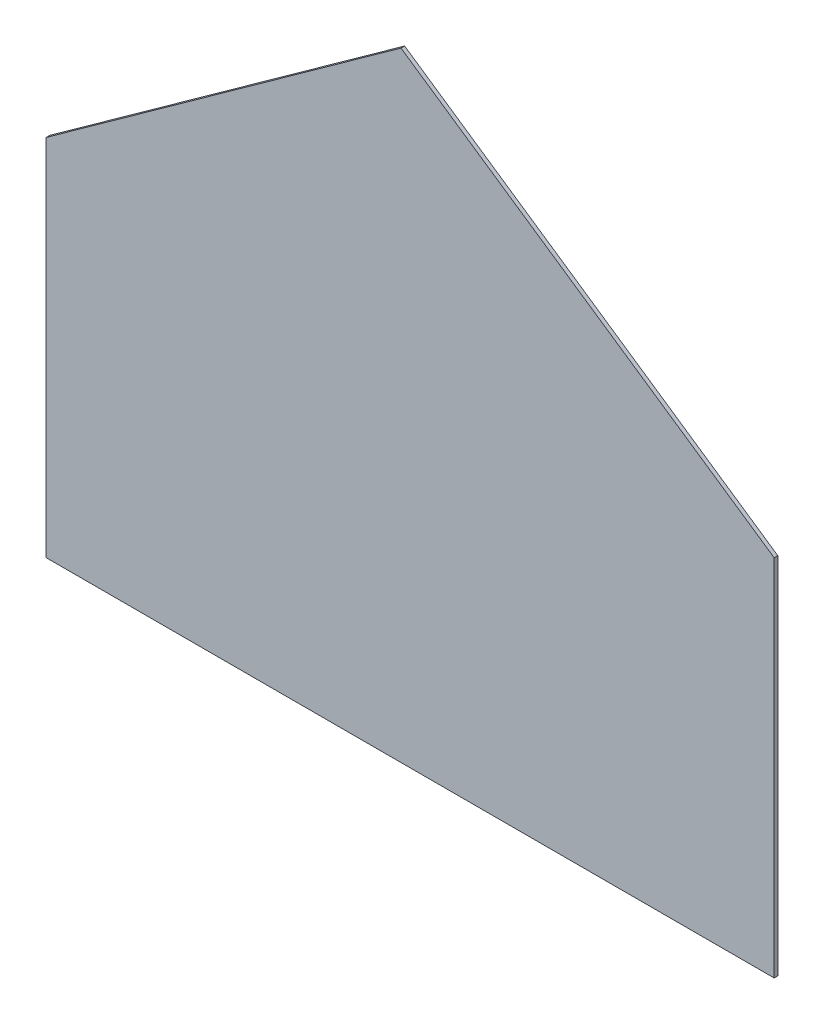
from build123d import *

# Parameters (mm, degrees)
BOSS_EXTRUDE1_DEPTH = 1.27


with BuildPart() as part:
    # Sketch1 → Boss-Extrude1 (new, symmetric)
    with BuildSketch(Plane.XY):
        Polygon((-254, 0), (254, 0), (254, 254), (-6.414612797, 431.776590257), (-254, 254), align=None)
    extrude(amount=BOSS_EXTRUDE1_DEPTH, both=True)


solid = part.part
